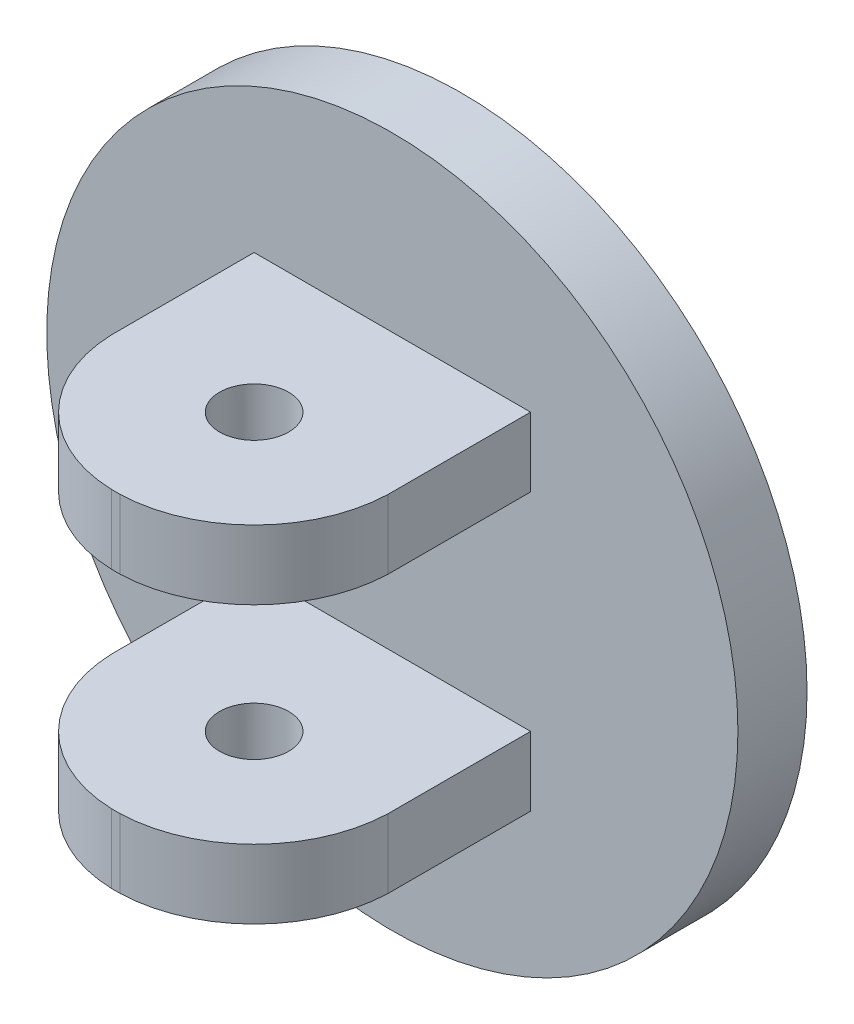
from build123d import *

# Parameters (mm, degrees)
SKETCH1_R               = 50
BOSS_EXTRUDE1_DEPTH     = 10
BOSS_EXTRUDE2_DEPTH     = 40
CUT_EXTRUDE1_DEPTH      = 10
CUT_EXTRUDE1_DEPTH_BACK = 51
SKETCH3_R               = 5
CUT_EXTRUDE2_DEPTH      = 51
CUT_EXTRUDE2_DEPTH_BACK = 51


with BuildPart() as part:
    # Sketch1 → Boss-Extrude1 (new body)
    with BuildSketch(Plane.XY):
        Circle(SKETCH1_R)
    extrude(amount=BOSS_EXTRUDE1_DEPTH)

    # Sketch2 → Boss-Extrude2 (add)
    with BuildSketch(Plane.XY.offset(10)):
        Polygon((0, 15), (20, 15), (20, 25), (0, 25), (-20, 25), (-20, 15), align=None)
        Polygon((0, -15), (20, -15), (20, -25), (0, -25), (-20, -25), (-20, -15), align=None)
    extrude(amount=BOSS_EXTRUDE2_DEPTH)

    # Sketch3 → Cut-Extrude1 (cut, two sides: drawn at the far end of the back side and taken through both)
    with BuildSketch(Plane(origin=(0, 25, 0), x_dir=(1, 0, 0), z_dir=(0, 1, 0)).offset(-CUT_EXTRUDE1_DEPTH_BACK)):
        with Locations((0, -30)):
            Circle(SKETCH3_R)
    extrude(amount=CUT_EXTRUDE1_DEPTH + CUT_EXTRUDE1_DEPTH_BACK, mode=Mode.SUBTRACT)

    # Sketch4 → Cut-Extrude2 (cut, two sides: drawn at the far end of the back side and taken through both)
    with BuildSketch(Plane.XZ.offset(25).offset(-CUT_EXTRUDE2_DEPTH_BACK)):
        with BuildLine():
            Line((-20, 30.622391971), (-26.002102492, 30.622391971))
            Line((-26.002102492, 30.622391971), (-24.526146123, 56.726211349))
            Line((-24.526146123, 56.726211349), (26.177296222, 55.337075942))
            Line((26.177296222, 55.337075942), (30.171060516, 28.596219363))
            Line((30.171060516, 28.596219363), (20, 29.377608029))
            ThreePointArc((20, 29.377608029), (0.622391971, 50), (-20, 30.622391971))
        make_face()
    extrude(amount=CUT_EXTRUDE2_DEPTH + CUT_EXTRUDE2_DEPTH_BACK, mode=Mode.SUBTRACT)


solid = part.part
